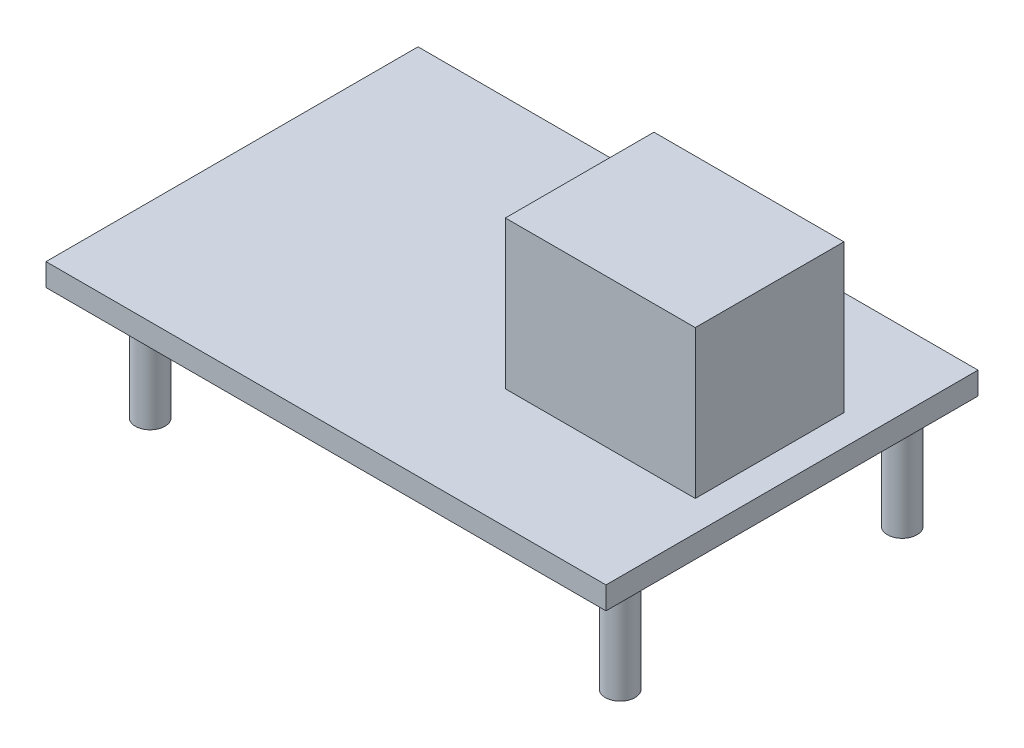
from build123d import *

# Parameters (mm, degrees)
SKETCH1_W           = 18.92
SKETCH1_H           = 12.57
BOSS_EXTRUDE1_DEPTH = 0.76
SKETCH2_R           = 0.5
BOSS_EXTRUDE2_DEPTH = 3.55
SKETCH3_W           = 6.416319516
SKETCH3_H           = 5.020284278
BOSS_EXTRUDE3_DEPTH = 5


with BuildPart() as part:
    # Sketch1 → Boss-Extrude1 (new body)
    with BuildSketch(Plane(origin=(0, 0, 0), x_dir=(1, 0, 0), z_dir=(0, 1, 0))):
        with Locations((9.46, -6.285)):
            Rectangle(SKETCH1_W, SKETCH1_H)
    extrude(amount=BOSS_EXTRUDE1_DEPTH)

    # Sketch2 → Boss-Extrude2 (add)
    with BuildSketch(Plane(origin=(0, 0, 0), x_dir=(-1, 0, 0), z_dir=(0, -1, 0))):
        with Locations(Location((-2.02, -11.07, 0), (0, 0, 270))):
            Circle(SKETCH2_R)
        with Locations(Location((-17.9, -11.07, 0), (0, 0, 270))):
            Circle(SKETCH2_R)
        with Locations(Location((-2.02, -7.89, 0), (0, 0, 270))):
            Circle(SKETCH2_R)
        with Locations(Location((-2.02, -1.54, 0), (0, 0, 270))):
            Circle(SKETCH2_R)
        with Locations(Location((-17.9, -1.54, 0), (0, 0, 270))):
            Circle(SKETCH2_R)
    extrude(amount=BOSS_EXTRUDE2_DEPTH)

    # Sketch3 → Boss-Extrude3 (add)
    with BuildSketch(Plane(origin=(0, 0.76, 0), x_dir=(1, 0, 0), z_dir=(0, 1, 0))):
        with Locations((14.691840242, -6.022310706)):
            Rectangle(SKETCH3_W, SKETCH3_H)
    extrude(amount=BOSS_EXTRUDE3_DEPTH)


solid = part.part
